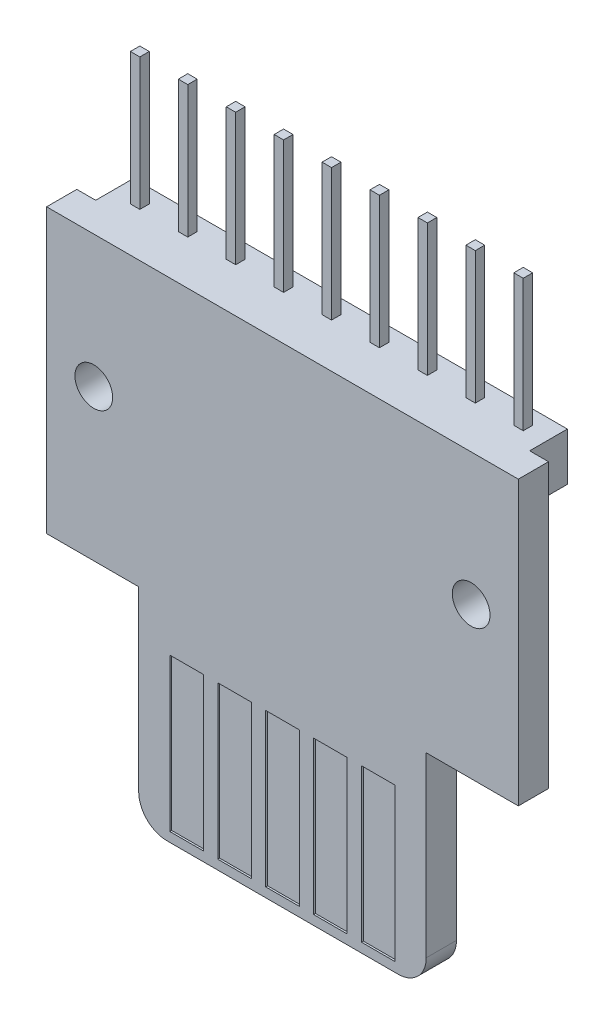
from build123d import *

# Parameters (mm, degrees)
SKETCH_1_R          = 1
EXTRUDE_1_DEPTH     = 1.6
SKETCH_2_W          = 1.78
SKETCH_2_H          = 8.1
CUT_EXTRUDE_1_DEPTH = 0.1
CUT_EXTRUDE_START   = 1.6
SKETCH_3_W          = 1.78
SKETCH_3_H          = 8.1
CUT_EXTRUDE_2_DEPTH = 0.1
SKETCH_4_W          = 23
SKETCH_4_H          = 2.54
EXTRUDE_2_DEPTH     = 2
EXTRUDE_START       = 15
SKETCH_5_W          = 0.5
SKETCH_5_H          = 0.5
EXTRUDE_3_DEPTH     = 7


with BuildPart() as part:
    # 草图1 → 凸台-拉伸1 (new body)
    with BuildSketch(Plane.XY):
        with BuildLine():
            Line((-12.5, 0), (-7.62, 0))
            Line((-7.62, 0), (-7.62, -9.41))
            ThreePointArc((-7.62, -9.41), (-7.180660172, -10.470660172), (-6.12, -10.91))
            Line((-6.12, -10.91), (6.12, -10.91))
            ThreePointArc((6.12, -10.91), (7.180660172, -10.470660172), (7.62, -9.41))
            Line((7.62, -9.41), (7.62, 0))
            Line((7.62, 0), (12.5, 0))
            Line((12.5, 0), (12.5, 15))
            Line((12.5, 15), (-12.5, 15))
            Line((-12.5, 15), (-12.5, 0))
        make_face()
        with Locations((-10, 8)):
            Circle(SKETCH_1_R, mode=Mode.SUBTRACT)
        with Locations((10, 8)):
            Circle(SKETCH_1_R, mode=Mode.SUBTRACT)
    extrude(amount=EXTRUDE_1_DEPTH)

    # 草图2 → 切除-拉伸1 (cut)
    with BuildSketch(Plane.XY):
        with Locations((0, -6.36)):
            Rectangle(SKETCH_2_W, SKETCH_2_H)
        with Locations((2.54, -6.36)):
            Rectangle(SKETCH_2_W, SKETCH_2_H)
        with Locations((5.08, -6.36)):
            Rectangle(SKETCH_2_W, SKETCH_2_H)
        with Locations((-2.54, -6.36)):
            Rectangle(SKETCH_2_W, SKETCH_2_H)
        with Locations((-5.08, -6.36)):
            Rectangle(SKETCH_2_W, SKETCH_2_H)
    extrude(amount=CUT_EXTRUDE_1_DEPTH, mode=Mode.SUBTRACT)

    # 草图3 → 切除-拉伸2 (cut)
    with BuildSketch(Plane.XY.offset(CUT_EXTRUDE_START)):
        with Locations((2.54, -6.36)):
            Rectangle(SKETCH_3_W, SKETCH_3_H)
        with Locations((0, -6.36)):
            Rectangle(SKETCH_3_W, SKETCH_3_H)
        with Locations((-5.08, -6.36)):
            Rectangle(SKETCH_3_W, SKETCH_3_H)
        with Locations((-2.54, -6.36)):
            Rectangle(SKETCH_3_W, SKETCH_3_H)
        with Locations((5.08, -6.36)):
            Rectangle(SKETCH_3_W, SKETCH_3_H)
    extrude(amount=-CUT_EXTRUDE_2_DEPTH, mode=Mode.SUBTRACT)

    # 草图4 → 凸台-拉伸2 (add)
    with BuildSketch(Plane.XY):
        with Locations((0, 13.73)):
            Rectangle(SKETCH_4_W, SKETCH_4_H)
    extrude(amount=-EXTRUDE_2_DEPTH)

    # 草图5 → 凸台-拉伸3 (add)
    with BuildSketch(Plane(origin=(0, 0, 0), x_dir=(1, 0, 0), z_dir=(0, 1, 0)).offset(EXTRUDE_START)):
        with Locations((2.54, 1)):
            Rectangle(SKETCH_5_W, SKETCH_5_H)
        with Locations((0, 1)):
            Rectangle(SKETCH_5_W, SKETCH_5_H)
        with Locations((5.08, 1)):
            Rectangle(SKETCH_5_W, SKETCH_5_H)
        with Locations((7.62, 1)):
            Rectangle(SKETCH_5_W, SKETCH_5_H)
        with Locations((10.16, 1)):
            Rectangle(SKETCH_5_W, SKETCH_5_H)
        with Locations((-2.54, 1)):
            Rectangle(SKETCH_5_W, SKETCH_5_H)
        with Locations((-5.08, 1)):
            Rectangle(SKETCH_5_W, SKETCH_5_H)
        with Locations((-7.62, 1)):
            Rectangle(SKETCH_5_W, SKETCH_5_H)
        with Locations((-10.16, 1)):
            Rectangle(SKETCH_5_W, SKETCH_5_H)
    extrude(amount=EXTRUDE_3_DEPTH)


solid = part.part
